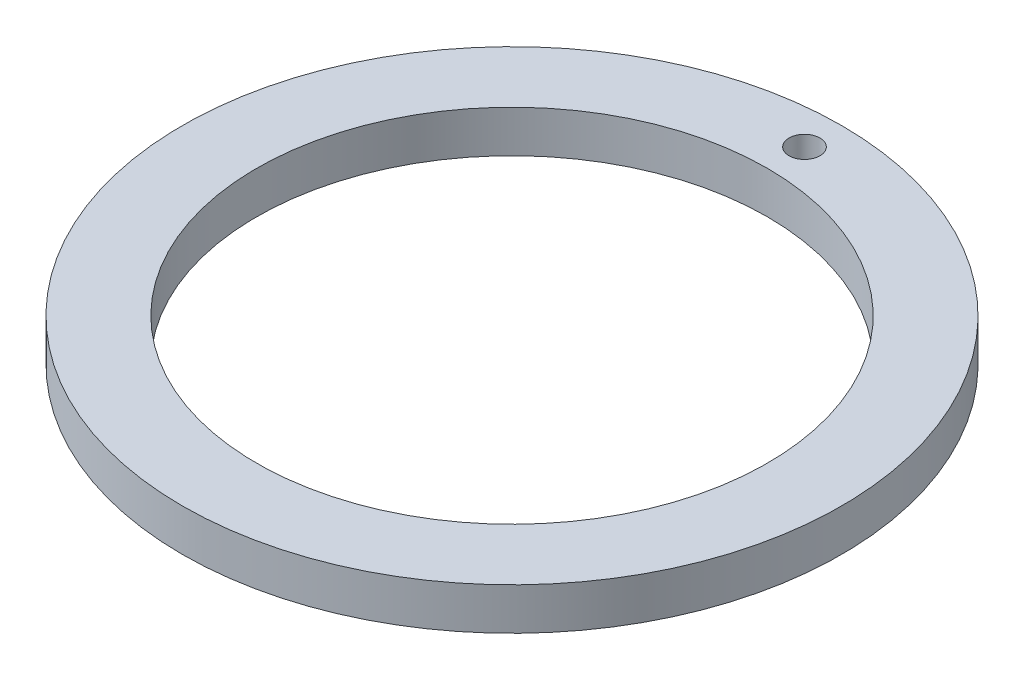
from build123d import *

# Parameters (mm, degrees)
SKETCH1_R           = 50.8
BOSS_EXTRUDE1_DEPTH = 6.477
SKETCH3_R           = 39.37
CUT_EXTRUDE1_DEPTH  = 6.477
SKETCH4_R           = 2.38125
CUT_EXTRUDE2_DEPTH  = 6.477


with BuildPart() as part:
    # Sketch1 → Boss-Extrude1 (new body)
    with BuildSketch(Plane(origin=(0, 0, 0), x_dir=(1, 0, 0), z_dir=(0, 1, 0))):
        with Locations(Location((0, 0, 0), (0, 0, 270))):
            Circle(SKETCH1_R)
    extrude(amount=BOSS_EXTRUDE1_DEPTH)

    # Sketch3 → Cut-Extrude1 (cut)
    with BuildSketch(Plane(origin=(0, 0, 0), x_dir=(-1, 0, 0), z_dir=(0, -1, 0))):
        with Locations(Location((0, 0, 0), (0, 0, 90))):
            Circle(SKETCH3_R)
    extrude(amount=-CUT_EXTRUDE1_DEPTH, mode=Mode.SUBTRACT)

    # Sketch4 → Cut-Extrude2 (cut)
    with BuildSketch(Plane.XZ):
        with Locations(Location((0, -45.085, 0), (0, 0, 270))):
            Circle(SKETCH4_R)
    extrude(amount=-CUT_EXTRUDE2_DEPTH, mode=Mode.SUBTRACT)


solid = part.part
